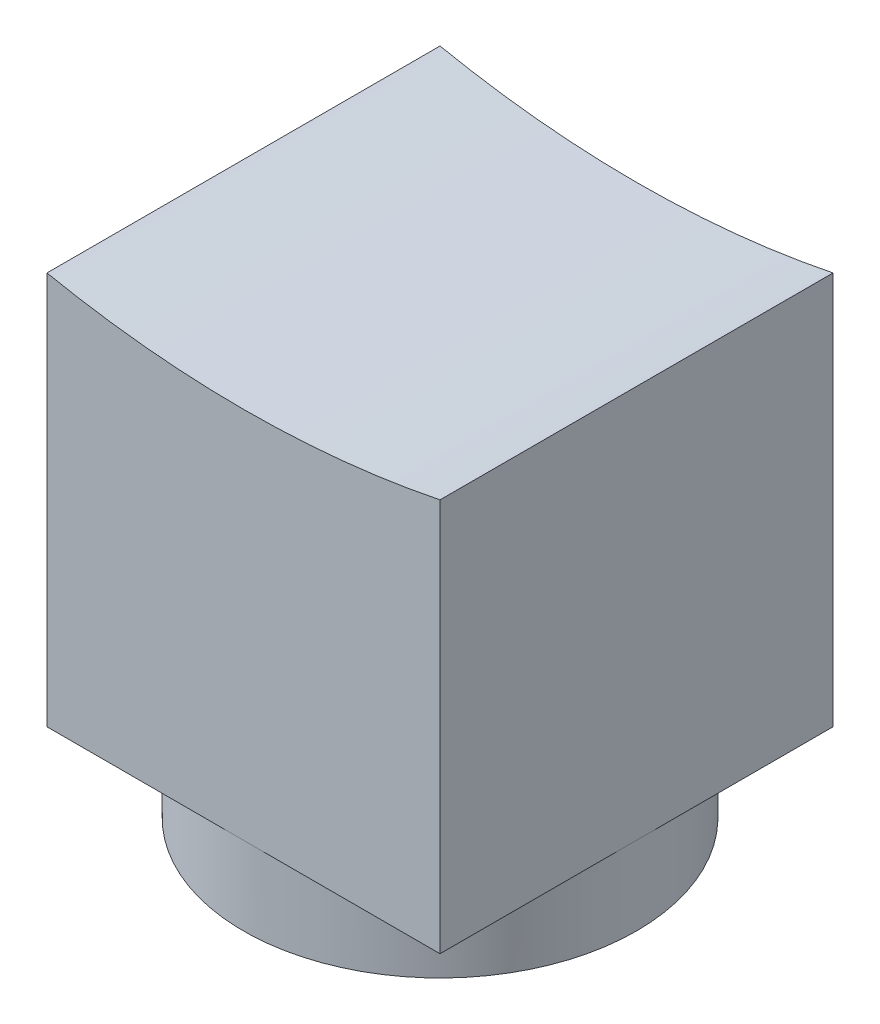
from build123d import *

# Parameters (mm, degrees)
BOSS_EXTRUDE1_DEPTH = 50
SKETCH2_R           = 25
BOSS_EXTRUDE2_DEPTH = 10


with BuildPart() as part:
    # Sketch1 → Boss-Extrude1 (new body)
    with BuildSketch(Plane.XY):
        with BuildLine():
            Line((25, 25), (25, -25))
            Line((25, -25), (-25, -25))
            Line((-25, -25), (-25, 25))
            ThreePointArc((-25, 25), (0, 22.474363409), (25, 25))
        make_face()
    extrude(amount=BOSS_EXTRUDE1_DEPTH)

    # Sketch2 → Boss-Extrude2 (add)
    with BuildSketch(Plane.XZ.offset(25)):
        with Locations((0, 25)):
            Circle(SKETCH2_R)
    extrude(amount=BOSS_EXTRUDE2_DEPTH)


solid = part.part
